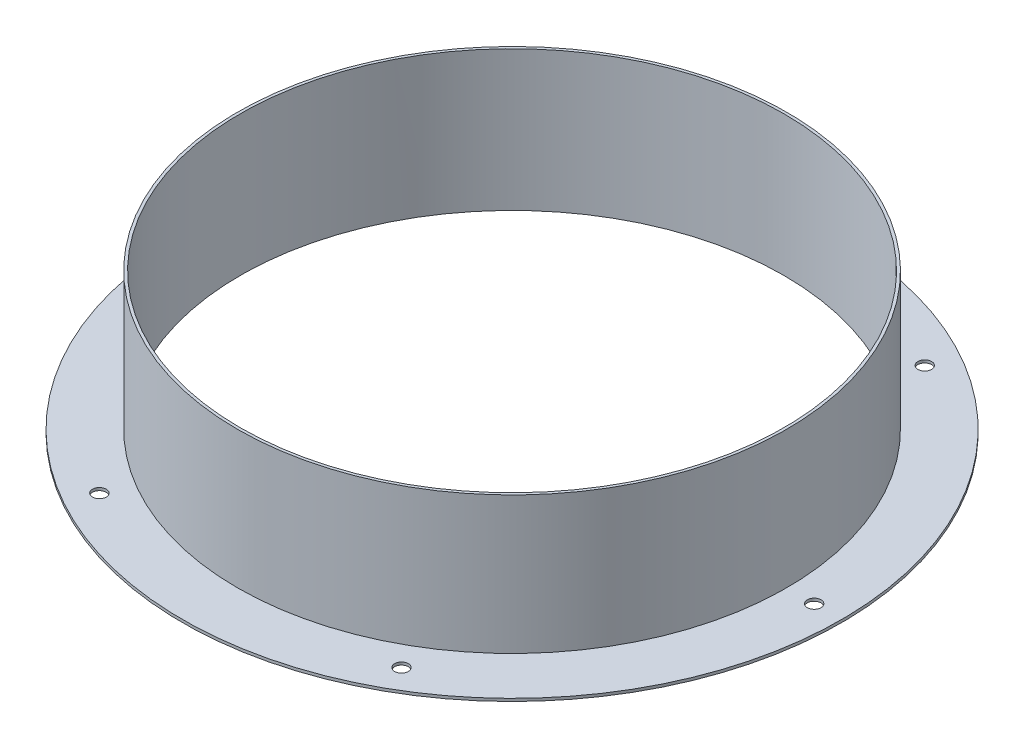
from build123d import *
from build123d.topology import SkipClean

# Parameters (mm, degrees)
SKETCH1_R           = 100
SKETCH1_R_2         = 99
BOSS_EXTRUDE1_DEPTH = 50
BOSS_EXTRUDE2_START = 1
SKETCH2_R           = 120
SKETCH2_R_2         = 99
BOSS_EXTRUDE2_DEPTH = 1
SKETCH3_R           = 2.5
CUT_EXTRUDE1_DEPTH  = 1


with BuildPart() as part:
    # Sketch1 → Boss-Extrude1 (new body)
    with BuildSketch(Plane(origin=(0, 0, 0), x_dir=(1, 0, 0), z_dir=(0, 1, 0))):
        with Locations(Location((0, 0, 0), (0, 0, 270))):
            Circle(SKETCH1_R)
        with Locations(Location((0, 0, 0), (0, 0, 270))):
            Circle(SKETCH1_R_2, mode=Mode.SUBTRACT)
    extrude(amount=BOSS_EXTRUDE1_DEPTH)

    # Sketch2 → Boss-Extrude2 (add)
    with SkipClean():  # the faces are left unmerged after this step: merging them gives an invalid solid
        with BuildSketch(Plane.XZ.offset(BOSS_EXTRUDE2_START)):
            with Locations(Location((0, 0, 0), (0, 0, 270))):
                Circle(SKETCH2_R)
            with Locations(Location((0, 0, 0), (0, 0, 270))):
                Circle(SKETCH2_R_2, mode=Mode.SUBTRACT)
        extrude(amount=-BOSS_EXTRUDE2_DEPTH)

    # Sketch3 → Cut-Extrude1 (cut)
    with SkipClean():  # the faces are left unmerged after this step: merging them gives an invalid solid
        with BuildSketch(Plane(origin=(0, 0, 0), x_dir=(1, 0, 0), z_dir=(0, 1, 0))):
            with Locations(Location((-110, 0, 0), (0, 0, 270))):
                Circle(SKETCH3_R)
            with Locations(Location((-55, 95.262794416, 0), (0, 0, 270))):
                Circle(SKETCH3_R)
            with Locations(Location((55, 95.262794416, 0), (0, 0, 270))):
                Circle(SKETCH3_R)
            with Locations(Location((110, 0, 0), (0, 0, 270))):
                Circle(SKETCH3_R)
            with Locations(Location((55, -95.262794416, 0), (0, 0, 270))):
                Circle(SKETCH3_R)
            with Locations(Location((-55, -95.262794416, 0), (0, 0, 270))):
                Circle(SKETCH3_R)
        extrude(amount=-CUT_EXTRUDE1_DEPTH, mode=Mode.SUBTRACT)


solid = part.part
